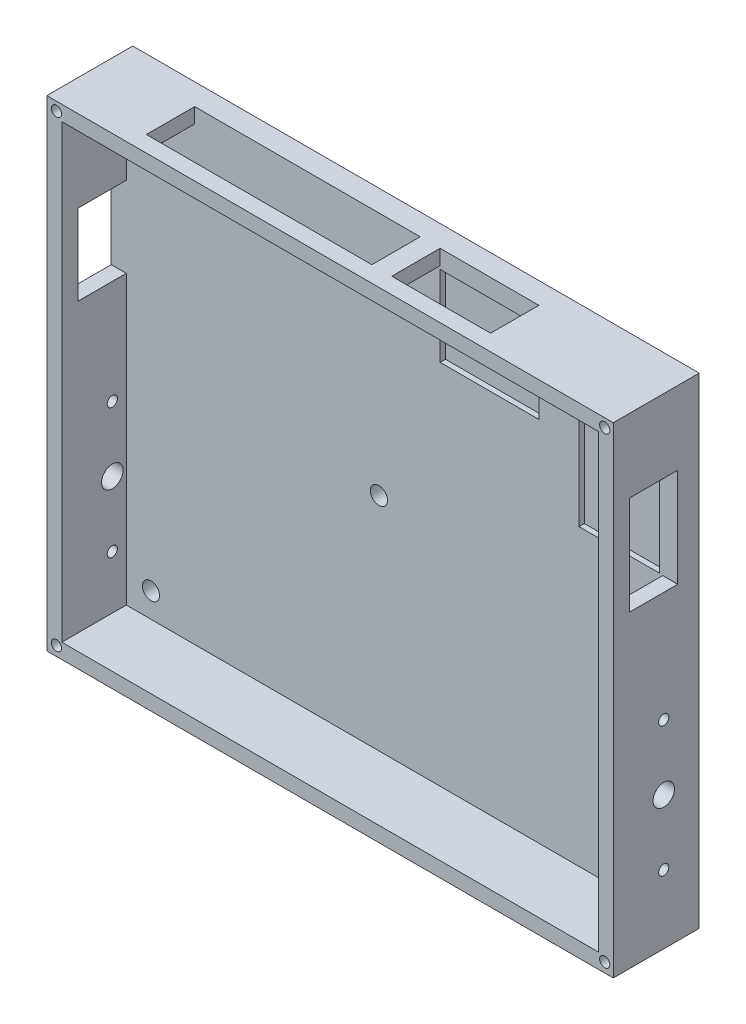
from build123d import *

# Parameters (mm, degrees)
SKETCH_3_W          = 52.75
SKETCH_3_H          = 44.78
EXTRUDE_1_DEPTH     = 2
HOLE_WIZARD_M2_1_D  = 1.6
CUT_EXTRUDE_START   = 2
SKETCH_3_5_W        = 9.2
SKETCH_3_5_H        = 7.5
SKETCH_3_5_W_2      = 7.5
SKETCH_3_5_H_2      = 9.2
CUT_EXTRUDE_2_DEPTH = 0.5
SKETCH_3_6_W        = 52.75
SKETCH_3_6_H        = 44.78
SKETCH_3_6_W_2      = 49.95
SKETCH_3_6_H_2      = 41.98
EXTRUDE_3_DEPTH     = 8
SKETCH_10_R         = 1
CUT_EXTRUDE_5_DEPTH = 69.574404117
M1_2X0_25_1_D       = 0.95
SKETCH_13_W         = 4.5
SKETCH_13_H         = 9.2
CUT_EXTRUDE_6_DEPTH = 2
SKETCH_14_W         = 9.2
SKETCH_14_H         = 4.5
SKETCH_14_W_2       = 21
CUT_EXTRUDE_7_DEPTH = 2
SKETCH_15_W         = 4.5
SKETCH_15_H         = 7.5
CUT_EXTRUDE_8_DEPTH = 2
M1_2X0_25_2_D       = 0.95


with BuildPart() as part:
    # 草图3 → 凸台-拉伸1 (new body)
    with BuildSketch(Plane.XY):
        with Locations((24.675, 20.69)):
            Rectangle(SKETCH_3_W, SKETCH_3_H)
    extrude(amount=EXTRUDE_1_DEPTH)

    # M2 螺纹孔1 (through all)
    with Locations(Plane(origin=(2.003, 2, 2), x_dir=(1, 0, 0), z_dir=(0, 0, 1))):
        with Locations((0, 0), (45.447, 0), (45.447, 37.357), (0, 37.357), (21.222, 18.3)):
            Hole(HOLE_WIZARD_M2_1_D / 2)

    # 草图3<5> → 切除-拉伸2 (cut)
    with BuildSketch(Plane.XY.offset(CUT_EXTRUDE_START)):
        with Locations((33.523, 37.63)):
            Rectangle(SKETCH_3_5_W, SKETCH_3_5_H)
        with Locations((45.6, 31.7)):
            Rectangle(SKETCH_3_5_W_2, SKETCH_3_5_H_2)
    extrude(amount=-CUT_EXTRUDE_2_DEPTH, mode=Mode.SUBTRACT)

    # 草图3<6> → 凸台-拉伸3 (add)
    with BuildSketch(Plane.XY):
        with Locations((24.675, 20.69)):
            Rectangle(SKETCH_3_6_W, SKETCH_3_6_H)
        with Locations((24.675, 20.69)):
            Rectangle(SKETCH_3_6_W_2, SKETCH_3_6_H_2, mode=Mode.SUBTRACT)
    extrude(amount=EXTRUDE_3_DEPTH)

    # 草图10 → 切除-拉伸5 (cut, through all)
    with BuildSketch(Plane.ZY.offset(1.7)):
        with Locations((3.3, 10.725)):
            Circle(SKETCH_10_R)
    extrude(amount=-CUT_EXTRUDE_5_DEPTH, mode=Mode.SUBTRACT)

    # M1.2x0.25 螺纹孔1 (through all)
    with Locations(Plane.ZY.offset(1.7)):
        with Locations((3.3, 16.775), (3.3, 4.675)):
            Hole(M1_2X0_25_1_D / 2)

    # 草图13 → 切除-拉伸6 (cut)
    with BuildSketch(Plane(origin=(51.05, 0, 0), x_dir=(0, 0, -1), z_dir=(1, 0, 0))):
        with Locations((-4.25, 31.65)):
            Rectangle(SKETCH_13_W, SKETCH_13_H)
    extrude(amount=-CUT_EXTRUDE_6_DEPTH, mode=Mode.SUBTRACT)

    # 草图14 → 切除-拉伸7 (cut)
    with BuildSketch(Plane(origin=(0, 43.08, 0), x_dir=(1, 0, 0), z_dir=(0, 1, 0))):
        with Locations((33.523, -4.25)):
            Rectangle(SKETCH_14_W, SKETCH_14_H)
        with Locations((16.57, -4.25)):
            Rectangle(SKETCH_14_W_2, SKETCH_14_H)
    extrude(amount=-CUT_EXTRUDE_7_DEPTH, mode=Mode.SUBTRACT)

    # 草图15 → 切除-拉伸8 (cut)
    with BuildSketch(Plane.ZY.offset(1.7)):
        with Locations((4.25, 30.2)):
            Rectangle(SKETCH_15_W, SKETCH_15_H)
    extrude(amount=-CUT_EXTRUDE_8_DEPTH, mode=Mode.SUBTRACT)

    # M1.2x0.25 螺纹孔2 (through all)
    with Locations(Plane(origin=(-0.8, -0.8, 8), x_dir=(1, 0, 0), z_dir=(0, 0, 1))):
        with Locations((0, 0), (51.05, 0), (51.05, 43.08), (0, 43.08)):
            Hole(M1_2X0_25_2_D / 2)


solid = part.part
